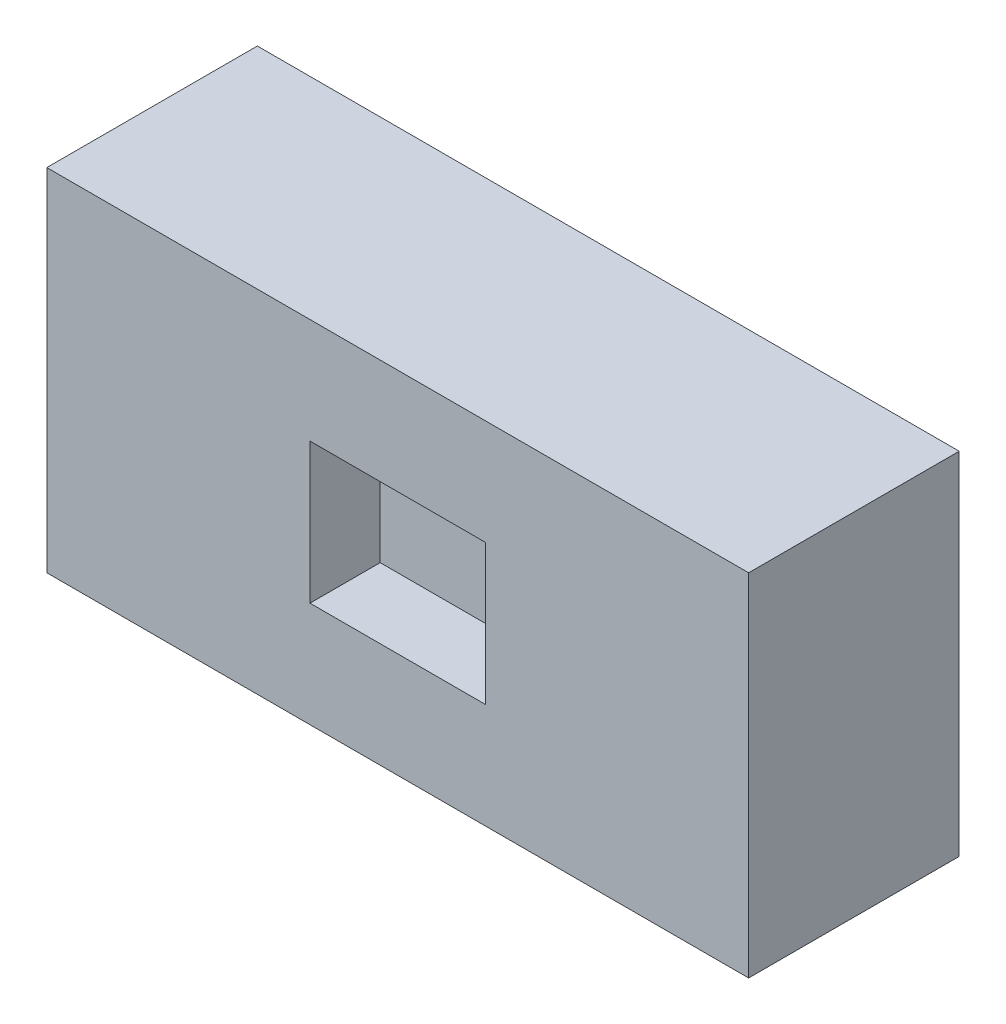
from build123d import *

# Parameters (mm, degrees)
RECTANGLESKETCH_W = 40
RECTANGLESKETCH_H = 20
BLINDBOSS_DEPTH   = 12
CUTSKETCH_W       = 10
CUTSKETCH_H       = 8
BLINDCUT_DEPTH    = 4


with BuildPart() as part:
    # RectangleSketch → BlindBoss (new body)
    with BuildSketch(Plane.XY):
        with Locations((20, 10)):
            Rectangle(RECTANGLESKETCH_W, RECTANGLESKETCH_H)
    extrude(amount=BLINDBOSS_DEPTH)

    # CutSketch → BlindCut (cut)
    with BuildSketch(Plane.XY.offset(12)):
        with Locations((20, 10)):
            Rectangle(CUTSKETCH_W, CUTSKETCH_H)
    extrude(amount=-BLINDCUT_DEPTH, mode=Mode.SUBTRACT)


solid = part.part
